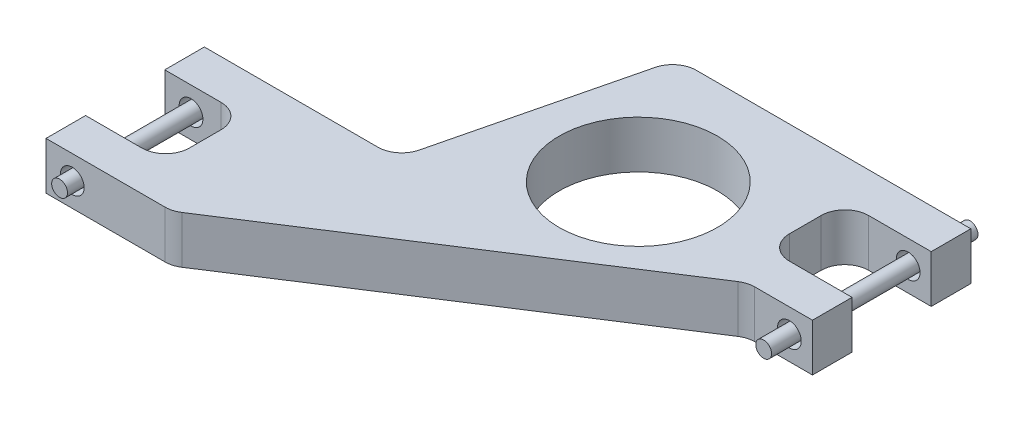
from build123d import *

# Parameters (mm, degrees)
SKETCH21_R         = 12.7
EXTRUDE1_DEPTH     = 3.81
SKETCH22_R         = 1.905
CUT_EXTRUDE1_DEPTH = 91.7575
SKETCH23_R         = 1.27
EXTRUDE2_DEPTH     = 33.114
EXTRUDE3_START     = 5.08
SKETCH23_3_R       = 1.27
EXTRUDE3_DEPTH     = 29.05


with BuildPart() as part:
    # Sketch21 → Extrude1 (new, symmetric)
    with BuildSketch(Plane(origin=(0, 0, 0), x_dir=(1, 0, 0), z_dir=(0, 1, 0))):
        with BuildLine():
            Line((-41.250206389, -6.691679553), (-69.101430131, -6.691679553))
            Line((-69.101430131, -6.691679553), (-69.101430131, -13.041679553))
            Line((-69.101430131, -13.041679553), (-60.073763005, -13.041679553))
            ThreePointArc((-60.073763005, -13.041679553), (-57.379686169, -14.157602716), (-56.263763005, -16.851679553))
            Line((-56.263763005, -16.851679553), (-56.263763005, -21.931679553))
            ThreePointArc((-56.263763005, -21.931679553), (-57.379686169, -24.625756389), (-60.073763005, -25.741679553))
            Line((-60.073763005, -25.741679553), (-69.101430131, -25.741679553))
            Line((-69.101430131, -25.741679553), (-69.101430131, -32.091679553))
            Line((-69.101430131, -32.091679553), (-49.98896999, -32.091679553))
            ThreePointArc((-49.98896999, -32.091679553), (-48.911766071, -31.936229007), (-47.922463432, -31.482562344))
            Line((-47.922463432, -31.482562344), (6.292726052, 3.519045616))
            ThreePointArc((6.292726052, 3.519045616), (7.282028692, 3.972712279), (8.35923261, 4.128162824))
            Line((8.35923261, 4.128162824), (17.630956358, 4.128162824))
            Line((17.630956358, 4.128162824), (17.630956358, 10.478162824))
            Line((17.630956358, 10.478162824), (7.592541293, 10.478162824))
            ThreePointArc((7.592541293, 10.478162824), (4.898464456, 11.594085988), (3.782541293, 14.288162824))
            Line((3.782541293, 14.288162824), (3.782541293, 19.368162824))
            ThreePointArc((3.782541293, 19.368162824), (4.898464456, 22.062239661), (7.592541293, 23.178162824))
            Line((7.592541293, 23.178162824), (17.630956358, 23.178162824))
            Line((17.630956358, 23.178162824), (17.630956358, 29.528162824))
            Line((17.630956358, 29.528162824), (-26.407986655, 29.528162824))
            ThreePointArc((-26.407986655, 29.528162824), (-28.760244733, 28.715325138), (-30.108826164, 26.623638905))
            Line((-30.108826164, 26.623638905), (-37.549366881, -3.787155633))
            ThreePointArc((-37.549366881, -3.787155633), (-38.897948311, -5.878841866), (-41.250206389, -6.691679553))
        make_face()
        with Locations((-15.570369897, 9.388598571)):
            Circle(SKETCH21_R, mode=Mode.SUBTRACT)
    extrude(amount=EXTRUDE1_DEPTH, both=True)

    # Sketch22 → Cut-Extrude1 (cut, symmetric)
    with BuildSketch(Plane(origin=(0, 0, -29.528162824), x_dir=(-1, 0, 0), z_dir=(0, 0, -1))):
        with Locations((-13.928786076, 0)):
            Circle(SKETCH22_R)
        with Locations((64.887413377, 0.009280662)):
            Circle(SKETCH22_R)
    extrude(amount=CUT_EXTRUDE1_DEPTH, both=True, mode=Mode.SUBTRACT)


with BuildPart() as body_2:
    # Sketch23 → Extrude2 (new body)
    with BuildSketch(Plane.XY):
        with Locations((13.928786076, 0)):
            Circle(SKETCH23_R)
    extrude(amount=-EXTRUDE2_DEPTH)


with BuildPart() as body_3:
    # Sketch23<3> → Extrude3 (new body)
    with BuildSketch(Plane.XY.offset(EXTRUDE3_START)):
        with Locations((-64.887413377, 0.009280662)):
            Circle(SKETCH23_3_R)
    extrude(amount=EXTRUDE3_DEPTH)


solid = Compound([part.part, body_2.part, body_3.part])
